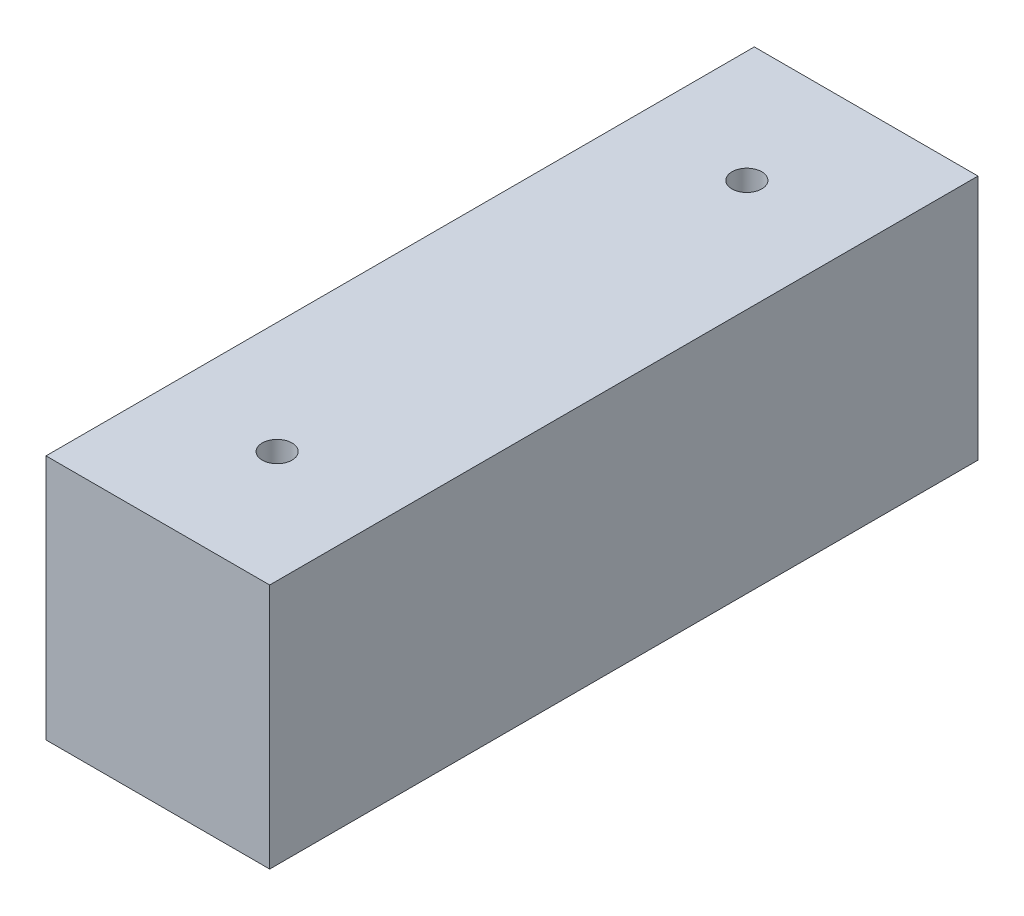
from build123d import *

# Parameters (mm, degrees)
CROQUIS1_W              = 30
CROQUIS1_H              = 33
SALIENTE_EXTRUIR1_DEPTH = 95
CROQUIS2_R              = 2
CORTAR_EXTRUIR1_DEPTH   = 5


with BuildPart() as part:
    # Croquis1 → Saliente-Extruir1 (new body)
    with BuildSketch(Plane.XY):
        Rectangle(CROQUIS1_W, CROQUIS1_H)
    extrude(amount=-SALIENTE_EXTRUIR1_DEPTH)

    # Croquis2 → Cortar-Extruir1 (cut)
    with BuildSketch(Plane(origin=(0, 16.5, 0), x_dir=(1, 0, 0), z_dir=(0, 1, 0))):
        with Locations(Location((0, 16, 0), (0, 0, 180))):
            Circle(CROQUIS2_R)
        with Locations((0, 79)):
            Circle(CROQUIS2_R)
    extrude(amount=-CORTAR_EXTRUIR1_DEPTH, mode=Mode.SUBTRACT)


solid = part.part
